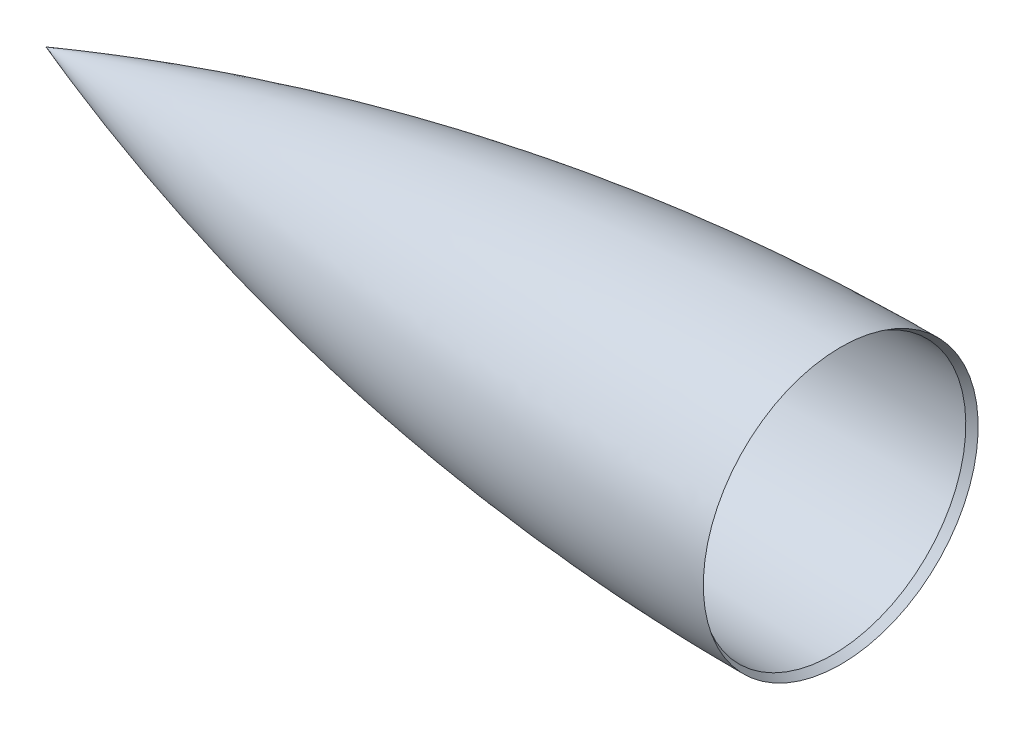
from build123d import *


with BuildPart() as part:
    # Sketch1 → Revolve1 (revolve)
    with BuildSketch(Plane.XY):
        with BuildLine():
            ThreePointArc((0, 39.6), (-116.199354559, 29.627075608), (-229, 0))
            Line((-229, 0), (-219.905427331, 0))
            ThreePointArc((-219.905427331, 0), (-152.242733977, 19.310557688), (-82.94478116, 31.514304881))
            Line((-82.94478116, 31.514304881), (-79.2, 33.676355292))
            ThreePointArc((-79.2, 33.676355292), (-40.794528926, 37.076367871), (-2.258154269, 38.296254025))
            Line((-2.258154269, 38.296254025), (0, 39.6))
        make_face()
    revolve(axis=Axis((0, 0, 0), (-1, 0, 0)))


solid = part.part
